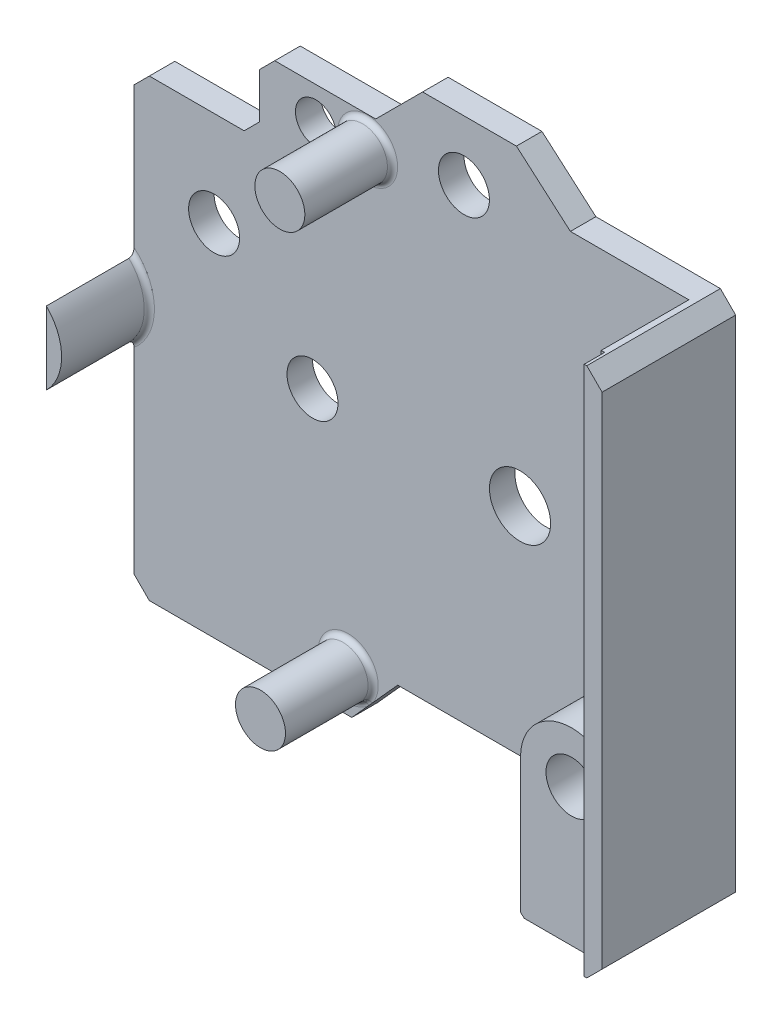
from build123d import *

# Parameters (mm, degrees)
SKETCH_1_R                      = 2.5
SKETCH_1_R_2                    = 3
EXTRUDE_1_DEPTH                 = 2.5
SKETCH_2_R                      = 2.45
SKETCH_2_R_2                    = 2.5
EXTRUDE_3_DEPTH                 = 8.6
CUT_EXTRUDE_1_REACH             = 53.724
SKETCH_2_2_R                    = 2.5
FILLET_1_R                      = 0.5
EXTRUDE_4_DEPTH                 = 8.6
FILLET_4_R                      = 1
CHAMFER_1_SIZE                  = 1
CUT_EXTRUDE_3_REACH             = 53.724
CUT_EXTRUDE_3_DIRECTION_2_DEPTH = 52.724136067
CHAMFER_2_SIZE                  = 1.5
CUT_EXTRUDE_5_REACH             = 53.724
CHAMFER_3_SIZE                  = 2
HOLE_WIZARD_M5_2_D              = 4.2
HOLE_WIZARD_M5_2_DEPTH          = 10
HOLE_WIZARD_M5_2_TIP            = 1.2618073
CUT_EXTRUDE_6_REACH             = 53.431
SKETCH_14_R                     = 2.5
CUT_EXTRUDE_7_DEPTH             = 52.431299391
CUT_EXTRUDE_7_DEPTH_BACK        = 52.431299391
SKETCH_15_W                     = 9
SKETCH_15_H                     = 44.55
SKETCH_15_W_2                   = 13.2
SKETCH_15_H_2                   = 52
SKETCH_17_R                     = 2.5
EXTRUDE_5_DEPTH                 = 3.5
FILLET_5_R                      = 2.4
SKETCH_18_W                     = 1.75
SKETCH_18_H                     = 52
EXTRUDE_6_DEPTH                 = 2
CHAMFER_4_SIZE                  = 1.5
SKETCH_19_R                     = 2
CUT_EXTRUDE_8_DEPTH             = 10


with BuildPart() as part:
    # 스케치1 → 보스-돌출1 (new body)
    with BuildSketch(Plane.XY):
        Polygon((-6.675534975, -27.705928987), (-2.173514753, -22.705928987), (13.286485247, -22.705928987), (18.839547821, -27.705928987), (41.669547821, -27.705928987), (41.669547821, 12.674071013), (30.011242494, 24.294071013), (14.761242494, 24.294071013), (9.469547821, 28.894071013), (0.269547821, 28.894071013), (-4.330452179, 24.294071013), (-27.130452179, 24.294071013), (-42.030452179, 9.394071013), (-42.030452179, -27.705928987), align=None)
        with Locations((-20.178757506, 7.504071013)):
            Circle(SKETCH_1_R, mode=Mode.SUBTRACT)
        with Locations((4.321242494, 23.004071013)):
            Circle(SKETCH_1_R, mode=Mode.SUBTRACT)
        with Locations((9.821242494, -1.495928987)):
            Circle(SKETCH_1_R_2, mode=Mode.SUBTRACT)
    extrude(amount=EXTRUDE_1_DEPTH)

    # 스케치2 → 보스-돌출3 (add)
    # profile 1 of 4: a face of its own
    with BuildSketch(Plane.XY.offset(2.5)):
        with Locations(Location((-5.130452179, 21.294071013, 0), (0, 0, 180))):
            Circle(SKETCH_2_R)
    # profile 2 of 4: a face of its own
    with BuildSketch(Plane.XY.offset(2.5)):
        with Locations(Location((-7.030452179, -23.705928987, 0), (0, 0, 180))):
            Circle(SKETCH_2_R)
    # profile 3 of 4: a face of its own
    with BuildSketch(Plane.XY.offset(2.5)):
        with BuildLine():
            Line((18.469547821, -14.205928987), (18.469547821, -27.37277949))
            Line((18.469547821, -27.37277949), (18.839547821, -27.705928987))
            Line((18.839547821, -27.705928987), (28.469547821, -27.705928987))
            Line((28.469547821, -27.705928987), (28.469547821, -14.205928987))
            Line((28.469547821, -14.205928987), (28.469547821, 24.294071013))
            Line((28.469547821, 24.294071013), (26.377590331, 24.294071013))
            Line((26.377590331, 24.294071013), (26.377590331, -10.138584797))
            ThreePointArc((26.377590331, -10.138584797), (21.182651731, -9.759570221), (18.469547821, -14.205928987))
        make_face()
        with Locations(Location((23.469547821, -14.205928987, 0), (0, 0, 180))):
            Circle(SKETCH_2_R_2, mode=Mode.SUBTRACT)
    # profile 4 of 4: a face of its own
    with BuildSketch(Plane.XY.offset(2.5)):
        with BuildLine():
            Line((-36.530452179, -2.705928987), (-36.530452179, -27.705928987))
            Line((-36.530452179, -27.705928987), (-29.030452179, -27.705928987))
            Line((-29.030452179, -27.705928987), (-29.030452179, -7.036056006))
            ThreePointArc((-29.030452179, -7.036056006), (-29.030452179, 1.624198032), (-36.530452179, -2.705928987))
        make_face()
        with Locations(Location((-31.530452179, -2.705928987, 0), (0, 0, 180))):
            Circle(SKETCH_2_R_2, mode=Mode.SUBTRACT)
    extrude(amount=EXTRUDE_3_DEPTH)

    # 스케치2<2> → 컷-돌출1 (cut, up to next)
    with BuildSketch(Plane.XY.offset(2.5), mode=Mode.PRIVATE) as cut_extrude_1_sk1:
        with Locations(Location((-31.530452179, -2.705928987, 0), (0, 0, 180))):
            Circle(SKETCH_2_2_R)
    cut_extrude_1_tool1 = extrude(cut_extrude_1_sk1.sketch, amount=-CUT_EXTRUDE_1_REACH, mode=Mode.PRIVATE) & part.part
    # 스케치2<2> → 컷-돌출1 (cut, up to next)
    with BuildSketch(Plane.XY.offset(2.5), mode=Mode.PRIVATE) as cut_extrude_1_sk2:
        with Locations(Location((23.469547821, -14.205928987, 0), (0, 0, 180))):
            Circle(SKETCH_2_2_R)
    cut_extrude_1_tool2 = extrude(cut_extrude_1_sk2.sketch, amount=-CUT_EXTRUDE_1_REACH, mode=Mode.PRIVATE) & part.part
    add(cut_extrude_1_tool1.solids().sort_by_distance((-31.530452, -2.705929, 2.5))[0], mode=Mode.SUBTRACT)
    add(cut_extrude_1_tool2.solids().sort_by_distance((23.469548, -14.205929, 2.5))[0], mode=Mode.SUBTRACT)

    # 필렛1
    fillet_1_edges = [part.edges().sort_by_distance(p)[0] for p in [
        (21.182651731, -9.759570221, 2.5),
        (-2.680452179, 21.294071013, 2.5),
        (-4.580452179, -23.705928987, 2.5),
        (18.469547821, -20.789354238, 2.5),
        (-36.530452179, -15.205928987, 2.5),
        (-29.030452179, -17.370992496, 2.5),
        (-29.030452179, 1.624198032, 2.5),
    ]]
    fillet(fillet_1_edges, radius=FILLET_1_R)

    # 스케치3 → 보스-돌출4 (add)
    with BuildSketch(Plane.XY.offset(2.5)):
        with BuildLine():
            Line((27.631077151, 8.755600344), (33.70801849, 8.755600344))
            ThreePointArc((33.70801849, 8.755600344), (34.415125271, 9.048493563), (34.70801849, 9.755600344))
            Line((34.70801849, 9.755600344), (34.70801849, 15.832541683))
            ThreePointArc((34.70801849, 15.832541683), (34.415125271, 16.539648464), (33.70801849, 16.832541683))
            Line((33.70801849, 16.832541683), (30.669547821, 16.832541683))
            ThreePointArc((30.669547821, 16.832541683), (27.813917825, 15.649701009), (26.631077151, 12.794071013))
            Line((26.631077151, 12.794071013), (26.631077151, 9.755600344))
            ThreePointArc((26.631077151, 9.755600344), (26.92397037, 9.048493563), (27.631077151, 8.755600344))
        make_face()
    extrude(amount=EXTRUDE_4_DEPTH)

    # 필렛4
    fillet_4_edges = [part.edges().sort_by_distance(p)[0] for p in [
        (29.522279368, 16.666153198, 2.5),
        (31.088783155, 8.755600344, 2.5),
        (32.188783155, 16.832541683, 2.5),
        (34.415125271, 9.048493563, 2.5),
        (34.70801849, 12.794071013, 2.5),
        (34.415125271, 16.539648464, 2.5),
    ]]
    fillet(fillet_4_edges, radius=FILLET_4_R)

    # 모따기1
    chamfer_1_edges = [part.edges().sort_by_distance(p)[0] for p in [
        (41.669547821, -27.705928987, 1.25),
        (-42.030452179, -27.705928987, 1.25),
    ]]
    chamfer(chamfer_1_edges, length=CHAMFER_1_SIZE)

    # 스케치8 → 컷-돌출3 (cut, up to next)
    with BuildSketch(Plane.XY.offset(2.5), mode=Mode.PRIVATE) as cut_extrude_3_sk1:
        Polygon((-15.730452179, 24.294071013), (-15.730452179, 16.844071013), (-34.580452179, 16.844071013), (-27.130452179, 24.294071013), align=None)
    cut_extrude_3_tool1 = extrude(cut_extrude_3_sk1.sketch, amount=-CUT_EXTRUDE_3_REACH, mode=Mode.PRIVATE) & part.part
    add(cut_extrude_3_tool1.solids().sort_by_distance((-23.445852, 20.263272, 2.5))[0], mode=Mode.SUBTRACT)

    # 스케치8 → 컷-돌출3 direction 2 (cut)
    with BuildSketch(Plane.XY.offset(2.5)):
        Polygon((-15.730452179, 24.294071013), (-15.730452179, 16.844071013), (-34.580452179, 16.844071013), (-27.130452179, 24.294071013), align=None)
    extrude(amount=CUT_EXTRUDE_3_DIRECTION_2_DEPTH, mode=Mode.SUBTRACT)

    # 모따기2
    chamfer_2_edges = [part.edges().sort_by_distance(p)[0] for p in [
        (-15.730452179, 16.844071013, 1.25),
        (-15.730452179, 24.294071013, 1.25),
    ]]
    chamfer(chamfer_2_edges, length=CHAMFER_2_SIZE)

    # 스케치10 → 컷-돌출5 (cut, up to next)
    with BuildSketch(Plane.XY.offset(2.5), mode=Mode.PRIVATE) as cut_extrude_5_sk1:
        Polygon((-37.030452179, -27.705928987), (-37.030452179, -2.705928987), (-37.030452179, 14.394071013), (-42.030452179, 9.394071013), (-42.030452179, -26.705928987), (-41.030452179, -27.705928987), align=None)
    cut_extrude_5_tool1 = extrude(cut_extrude_5_sk1.sketch, amount=-CUT_EXTRUDE_5_REACH, mode=Mode.PRIVATE) & part.part
    add(cut_extrude_5_tool1.solids().sort_by_distance((-39.472224, -7.830275, 2.5))[0], mode=Mode.SUBTRACT)

    # 모따기3
    chamfer_3_edges = [part.edges().sort_by_distance(p)[0] for p in [
        (-37.030452179, -27.705928987, 1.25),
    ]]
    chamfer(chamfer_3_edges, length=CHAMFER_3_SIZE)

    # M5 나사 구멍2
    with Locations(Plane(origin=(23.469547821, -27.705928987, 7.05), x_dir=(0, 0, -1), z_dir=(0, -1, 0))):
        with Locations((0, 0), (0, -56.25)):
            Hole(HOLE_WIZARD_M5_2_D / 2, depth=HOLE_WIZARD_M5_2_DEPTH)
            with Locations((0, 0, -(HOLE_WIZARD_M5_2_DEPTH + HOLE_WIZARD_M5_2_TIP / 2))):  # 118° drill point
                Cone(0, HOLE_WIZARD_M5_2_D / 2, HOLE_WIZARD_M5_2_TIP, mode=Mode.SUBTRACT)

    # 스케치14 → 컷-돌출6 (cut, up to next)
    with BuildSketch(Plane.XY.offset(2.5), mode=Mode.PRIVATE) as cut_extrude_6_sk1:
        with Locations((-10.530452179, -1.705928987)):
            Circle(SKETCH_14_R)
    cut_extrude_6_tool1 = extrude(cut_extrude_6_sk1.sketch, amount=-CUT_EXTRUDE_6_REACH, mode=Mode.PRIVATE) & part.part
    add(cut_extrude_6_tool1.solids().sort_by_distance((-10.530452, -1.705929, 2.5))[0], mode=Mode.SUBTRACT)

    # 스케치15 → 컷-돌출7 (cut, two sides: drawn at the far end of the back side and taken through both)
    with BuildSketch(Plane.XY.offset(2.5).offset(-CUT_EXTRUDE_7_DEPTH_BACK)):
        with Locations((-32.530452179, -5.430928987)):
            Rectangle(SKETCH_15_W, SKETCH_15_H)
        with Locations((35.069547821, -1.705928987)):
            Rectangle(SKETCH_15_W_2, SKETCH_15_H_2)
    extrude(amount=CUT_EXTRUDE_7_DEPTH + CUT_EXTRUDE_7_DEPTH_BACK, mode=Mode.SUBTRACT)

    # 스케치17 → 보스-돌출5 (add)
    with BuildSketch(Plane.ZY.offset(-26.377590331)):
        with Locations(Location((6.5, 13.294071013, 0), (0, 0, 180))):
            Circle(SKETCH_17_R)
    extrude(amount=EXTRUDE_5_DEPTH)

    # 필렛5
    fillet_5_edges = [part.edges().sort_by_distance(p)[0] for p in [
        (22.877590331, 13.294071013, 9),
    ]]
    fillet(fillet_5_edges, radius=FILLET_5_R)

    # 스케치18 → 보스-돌출6 (add)
    with BuildSketch(Plane.XY.offset(11.1)):
        with Locations((27.594547821, -1.705928987)):
            Rectangle(SKETCH_18_W, SKETCH_18_H)
    extrude(amount=EXTRUDE_6_DEPTH)

    # 모따기4
    chamfer_4_edges = [part.edges().sort_by_distance(p)[0] for p in [
        (-28.030452179, -27.705928987, 1.25),
        (-28.030452179, 16.844071013, 1.25),
        (28.469547821, 24.294071013, 6.55),
        (28.469547821, -27.705928987, 6.55),
    ]]
    chamfer(chamfer_4_edges, length=CHAMFER_4_SIZE)

    # 스케치19 → 컷-돌출8 (cut)
    with BuildSketch(Plane.XY.offset(2.5)):
        with Locations((-10.200452179, 20.994071013)):
            Circle(SKETCH_19_R)
    extrude(amount=-CUT_EXTRUDE_8_DEPTH, mode=Mode.SUBTRACT)


solid = part.part
